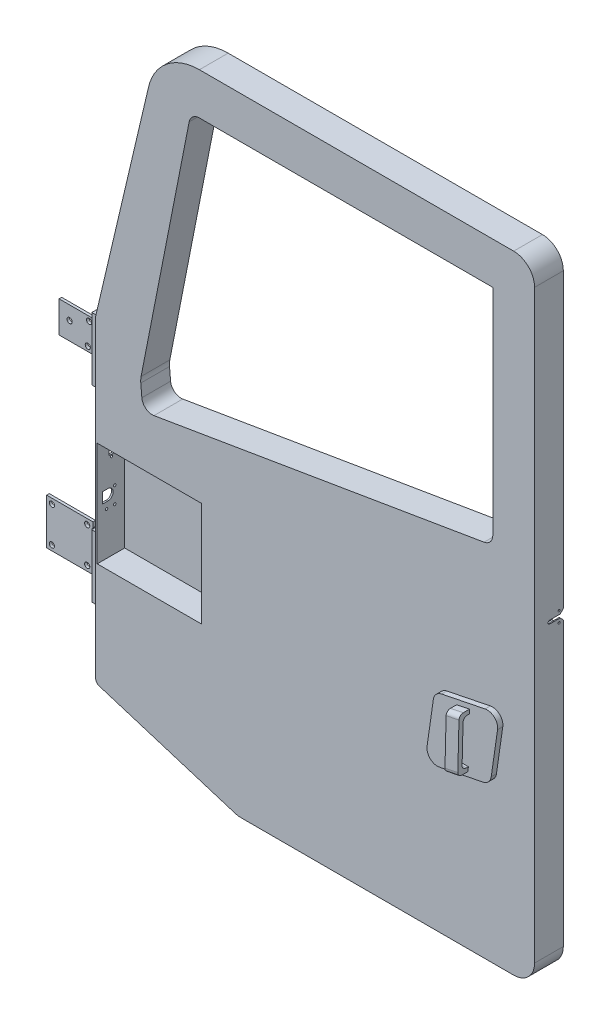
from build123d import *

# Parameters (mm, degrees)
BOSS_EXTRUDE1_DEPTH     = 34.925
BOSS_EXTRUDE2_DEPTH     = 12.7
BOSS_EXTRUDE4_DEPTH     = 38.1
CUT_EXTRUDE6_DEPTH      = 1209.353123139
CUT_EXTRUDE6_DEPTH_BACK = 1209.353123139
SKETCH6_W               = 15.24
SKETCH6_H               = 112.550701787
FILLET5_R               = 10.16
SKETCH7_W               = 63.5
SKETCH7_H               = 152.4
BOSS_EXTRUDE5_DEPTH     = 12.7
SKETCH16_W              = 254
SKETCH16_H              = 254
CUT_EXTRUDE8_DEPTH      = 66.675
SKETCH20_R              = 2.54
SKETCH20_W              = 12.7
SKETCH20_H              = 25.4
CUT_EXTRUDE12_DEPTH     = 3.81
SKETCH21_R              = 6.35
SKETCH21_W              = 12.7
SKETCH21_H              = 53.975
BOSS_EXTRUDE8_DEPTH     = 3.175
SKETCH26_W              = 25.4
SKETCH26_H              = 85.725
BOSS_EXTRUDE12_DEPTH    = 6.35
SKETCH27_W              = 112.7125
SKETCH27_H              = 111.125
SKETCH27_R              = 6.35
BOSS_EXTRUDE13_DEPTH    = 3.175
SKETCH28_R              = 3
CUT_EXTRUDE13_DEPTH     = 3.81
CUT_EXTRUDE14_DEPTH     = 2.54
CUT_EXTRUDE15_DEPTH     = 38.1
SKETCH31_R              = 2.54
CUT_EXTRUDE16_DEPTH     = 10.668


with BuildPart() as part:
    # Sketch2 → Boss-Extrude1 (new, symmetric)
    with BuildSketch(Plane.XY):
        with BuildLine():
            Line((-524.472141427, -657.200845349), (-194.857891611, -759.729501192))
            ThreePointArc((-194.857891611, -759.729501192), (-187.400192227, -761.445624463), (-179.769325902, -762.022025636))
            Line((-179.769325902, -762.022025636), (482.6, -762.022025636))
            ThreePointArc((482.6, -762.022025636), (518.521024484, -747.14305012), (533.4, -711.222025636))
            Line((533.4, -711.222025636), (533.4, 711.177974364))
            ThreePointArc((533.4, 711.177974364), (518.521024484, 747.098998848), (482.6, 761.977974364))
            Line((482.6, 761.977974364), (-281.22987981, 761.977974364))
            ThreePointArc((-281.22987981, 761.977974364), (-361.995192132, 732.98799592), (-405.888305034, 659.253003111))
            Line((-405.888305034, 659.253003111), (-533.4, 116.92602354))
            Line((-533.4, 116.92602354), (-533.4, -645.07397646))
            ThreePointArc((-533.4, -645.07397646), (-530.927321158, -652.603378956), (-524.472141427, -657.200845349))
        make_face()
        with BuildLine():
            Line((-306.172257077, 639.777746889), (-423.021910153, 45.403882754))
            ThreePointArc((-423.021910153, 45.403882754), (-423.905333497, 38.283472292), (-423.776767691, 31.109620274))
            Line((-423.776767691, 31.109620274), (-421.145810725, 1.492076496))
            ThreePointArc((-421.145810725, 1.492076496), (-411.377161007, -16.358363988), (-391.64022517, -21.309940154))
            Line((-391.64022517, -21.309940154), (410.604770812, 113.367925382))
            ThreePointArc((410.604770812, 113.367925382), (425.789915663, 122.010874728), (431.799559386, 138.417378922))
            Line((431.799559386, 138.417378922), (431.8, 660.377974364))
            Line((431.8, 660.377974364), (-281.22987981, 660.377974364))
            ThreePointArc((-281.22987981, 660.377974364), (-297.404640672, 654.562077894), (-306.172257077, 639.777746889))
        make_face(mode=Mode.SUBTRACT)
    extrude(amount=BOSS_EXTRUDE1_DEPTH, both=True)

    # Sketch3 → Boss-Extrude2 (add)
    with BuildSketch(Plane.XY.offset(34.925)):
        with BuildLine():
            Line((360.266650549, -236.97953971), (320.195939672, -245.101046406))
            ThreePointArc((320.195939672, -245.101046406), (306.776022753, -252.553855048), (300.10041124, -266.376833661))
            Line((300.10041124, -266.376833661), (284.73360266, -373.157176687))
            ThreePointArc((284.73360266, -373.157176687), (292.433567965, -395.240613926), (314.920066898, -401.669068776))
            Line((314.920066898, -401.669068776), (354.990777775, -393.547562081))
            Line((354.990777775, -393.547562081), (360.266650549, -236.97953971))
        make_face()
        with BuildLine():
            Line((425.926544142, -223.671633417), (385.855833265, -231.793140113))
            Line((385.855833265, -231.793140113), (380.579960491, -388.361162483))
            Line((380.579960491, -388.361162483), (420.650671368, -380.239655788))
            ThreePointArc((420.650671368, -380.239655788), (434.070588287, -372.786847145), (440.7461998, -358.963868533))
            Line((440.7461998, -358.963868533), (456.11300838, -252.183525507))
            ThreePointArc((456.11300838, -252.183525507), (448.413043075, -230.100088267), (425.926544142, -223.671633417))
        make_face()
        Polygon((385.855833265, -231.793140113), (360.266650549, -236.97953971), (354.990777775, -393.547562081), (380.579960491, -388.361162483), align=None)
    extrude(amount=BOSS_EXTRUDE2_DEPTH)

    # Sketch5 → Boss-Extrude4 (add)
    with BuildSketch(Plane.XY.offset(34.925)):
        Polygon((384.717168986, -375.860232263), (353.492653597, -382.188797573), (356.735325181, -249.357669916), (387.95984057, -243.029104606), align=None)
    extrude(amount=BOSS_EXTRUDE4_DEPTH)

    # Sketch6 → Cut-Extrude6 (cut, two sides: drawn at the far end of the back side and taken through both)
    with BuildSketch(Plane(origin=(393.658065015, -9.60997504, 0), x_dir=(0, 0, -1), z_dir=(0.9997021605932607, -0.02440471481427925, 0)).offset(-CUT_EXTRUDE6_DEPTH_BACK)):
        with Locations((-55.245, -299.924022588)):
            Rectangle(SKETCH6_W, SKETCH6_H)
    extrude(amount=CUT_EXTRUDE6_DEPTH + CUT_EXTRUDE6_DEPTH_BACK, mode=Mode.SUBTRACT)

    # Fillet5
    fillet5_edges = [part.edges().sort_by_distance(p)[0] for p in [
        (372.186129895, -252.807063957, 62.865),
        (369.439362115, -365.324243711, 62.865),
        (369.104911291, -379.024514918, 73.025),
        (372.347582875, -246.193387261, 73.025),
    ]]
    fillet(fillet5_edges, radius=FILLET5_R)

    # Sketch7 → Boss-Extrude5 (add)
    with BuildSketch(Plane(origin=(-533.4, 59.373810393, 0), x_dir=(0, 0, 1), z_dir=(1, 0, 0))):
        with Locations((0, 18.647786854)):
            Rectangle(SKETCH7_W, SKETCH7_H)
        with Locations((0, 475.847786854)):
            Rectangle(SKETCH7_W, SKETCH7_H)
    extrude(amount=-BOSS_EXTRUDE5_DEPTH)

    # Sketch16 → Cut-Extrude8 (cut)
    with BuildSketch(Plane.XY.offset(34.925)):
        with Locations((-402.59, -275.309940154)):
            Rectangle(SKETCH16_W, SKETCH16_H)
    extrude(amount=-CUT_EXTRUDE8_DEPTH, mode=Mode.SUBTRACT)

    # Sketch20 → Cut-Extrude12 (cut)
    with BuildSketch(Plane.ZY.offset(533.4)):
        with Locations(Location((0, -158.772025636, 0), (0, 0, 270))):
            Circle(SKETCH20_R)
        with Locations((0, -193.697025636)):
            Circle(SKETCH20_R)
        with Locations((0, -176.234525636)):
            Rectangle(SKETCH20_W, SKETCH20_H)
    extrude(amount=-CUT_EXTRUDE12_DEPTH, mode=Mode.SUBTRACT)

    # Sketch21 → Boss-Extrude8 (add, symmetric)
    # profile 1 of 2: a face of its own
    with BuildSketch(Plane.XY):
        Polygon((-558.8, 12.677974364), (-558.8, 66.652974364), (-558.8, 77.447974364), (-654.05, 77.447974364), (-654.05, 1.247974364), (-558.8, 1.247974364), align=None)
        with Locations((-584.2, 12.677974364)):
            Circle(SKETCH21_R, mode=Mode.SUBTRACT)
        with Locations((-628.65, 44.427974364)):
            Circle(SKETCH21_R, mode=Mode.SUBTRACT)
        with Locations((-581.025, 66.652974364)):
            Circle(SKETCH21_R, mode=Mode.SUBTRACT)
    # profile 2 of 2: a face of its own
    with BuildSketch(Plane.XY):
        with Locations((-552.45, 39.665474364)):
            Rectangle(SKETCH21_W, SKETCH21_H)
    extrude(amount=BOSS_EXTRUDE8_DEPTH, both=True)

    # Sketch26 → Boss-Extrude12 (add, symmetric)
    with BuildSketch(Plane.XY):
        with Locations((-558.8, -406.422025636)):
            Rectangle(SKETCH26_W, SKETCH26_H)
    extrude(amount=BOSS_EXTRUDE12_DEPTH, both=True)

    # Sketch27 → Boss-Extrude13 (add, symmetric)
    with BuildSketch(Plane.XY):
        with Locations((-627.85625, -406.422025636)):
            Rectangle(SKETCH27_W, SKETCH27_H)
        with Locations((-585.7875, -363.559525636)):
            Circle(SKETCH27_R, mode=Mode.SUBTRACT)
        with Locations((-671.5125, -449.284525636)):
            Circle(SKETCH27_R, mode=Mode.SUBTRACT)
        with Locations((-585.7875, -449.284525636)):
            Circle(SKETCH27_R, mode=Mode.SUBTRACT)
        with Locations((-671.5125, -363.559525636)):
            Circle(SKETCH27_R, mode=Mode.SUBTRACT)
    extrude(amount=BOSS_EXTRUDE13_DEPTH, both=True)

    # Sketch28 → Cut-Extrude13 (cut)
    with BuildSketch(Plane.ZY.offset(533.4)):
        with Locations(Location((-7.705, -258.147025636, 0), (0, 0, 270))):
            Circle(SKETCH28_R)
        with Locations(Location((-7.705, -298.147025636, 0), (0, 0, 270))):
            Circle(SKETCH28_R)
        with Locations(Location((12.295, -298.147025636, 0), (0, 0, 270))):
            Circle(SKETCH28_R)
        with BuildLine():
            Line((9.225, -256.897025636), (22.225, -256.897025636))
            Line((22.225, -256.897025636), (22.225, -282.897025636))
            Line((22.225, -282.897025636), (9.225, -282.897025636))
            ThreePointArc((9.225, -282.897025636), (-3.775, -269.897025636), (9.225, -256.897025636))
        make_face()
    extrude(amount=-CUT_EXTRUDE13_DEPTH, mode=Mode.SUBTRACT)

    # Sketch29 → Cut-Extrude14 (cut)
    with BuildSketch(Plane(origin=(533.4, 0, 0), x_dir=(0, 0, -1), z_dir=(1, 0, 0))):
        with BuildLine():
            Line((27.305, -15.897025636), (34.925, -23.517025636))
            Line((34.925, -23.517025636), (34.925, -15.897025636))
            Line((34.925, -15.897025636), (34.925, -0.022025636))
            Line((34.925, -0.022025636), (27.305, -7.642025636))
            Line((27.305, -7.642025636), (1.938532156, -7.642025636))
            ThreePointArc((1.938532156, -7.642025636), (-2.188967844, -11.769525636), (1.938532156, -15.897025636))
            Line((1.938532156, -15.897025636), (27.305, -15.897025636))
        make_face()
    extrude(amount=-CUT_EXTRUDE14_DEPTH, mode=Mode.SUBTRACT)

    # Sketch30 → Cut-Extrude15 (cut)
    with BuildSketch(Plane(origin=(0, 0, -34.925), x_dir=(-1, 0, 0), z_dir=(0, 0, -1))):
        Polygon((-530.86, -11.769525636), (-530.86, 13.630474364), (-505.46, 13.630474364), (-505.46, -37.169525636), (-530.86, -37.169525636), align=None)
    extrude(amount=-CUT_EXTRUDE15_DEPTH, mode=Mode.SUBTRACT)

    # Sketch31 → Cut-Extrude16 (cut)
    with BuildSketch(Plane(origin=(533.4, 0, 0), x_dir=(0, 0, -1), z_dir=(1, 0, 0))):
        with Locations(Location((24.765, 0.930474364, 0), (0, 0, 90))):
            Circle(SKETCH31_R)
        with Locations(Location((24.765, -24.469525636, 0), (0, 0, 90))):
            Circle(SKETCH31_R)
    extrude(amount=-CUT_EXTRUDE16_DEPTH, mode=Mode.SUBTRACT)


solid = part.part
